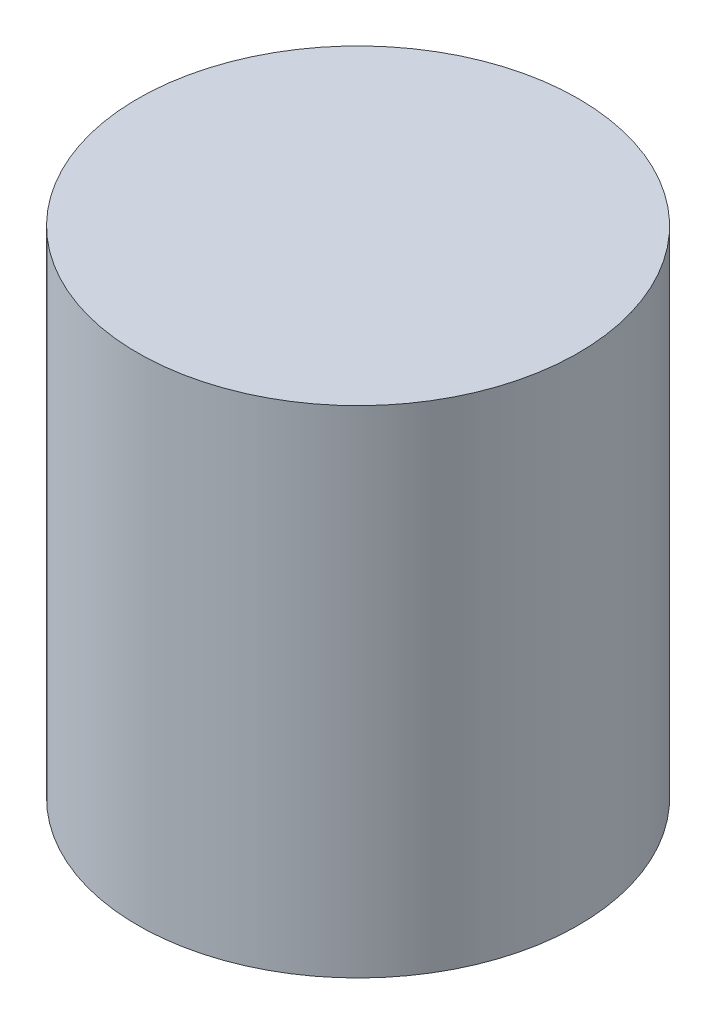
from build123d import *

# Parameters (mm, degrees)
SKETCH1_R           = 20
BOSS_EXTRUDE1_DEPTH = 45


with BuildPart() as part:
    # Sketch1 → Boss-Extrude1 (new body)
    with BuildSketch(Plane(origin=(0, 0, 0), x_dir=(1, 0, 0), z_dir=(0, 1, 0))):
        with Locations(Location((0, 0, 0), (0, 0, 90))):
            Circle(SKETCH1_R)
    extrude(amount=BOSS_EXTRUDE1_DEPTH)


solid = part.part
